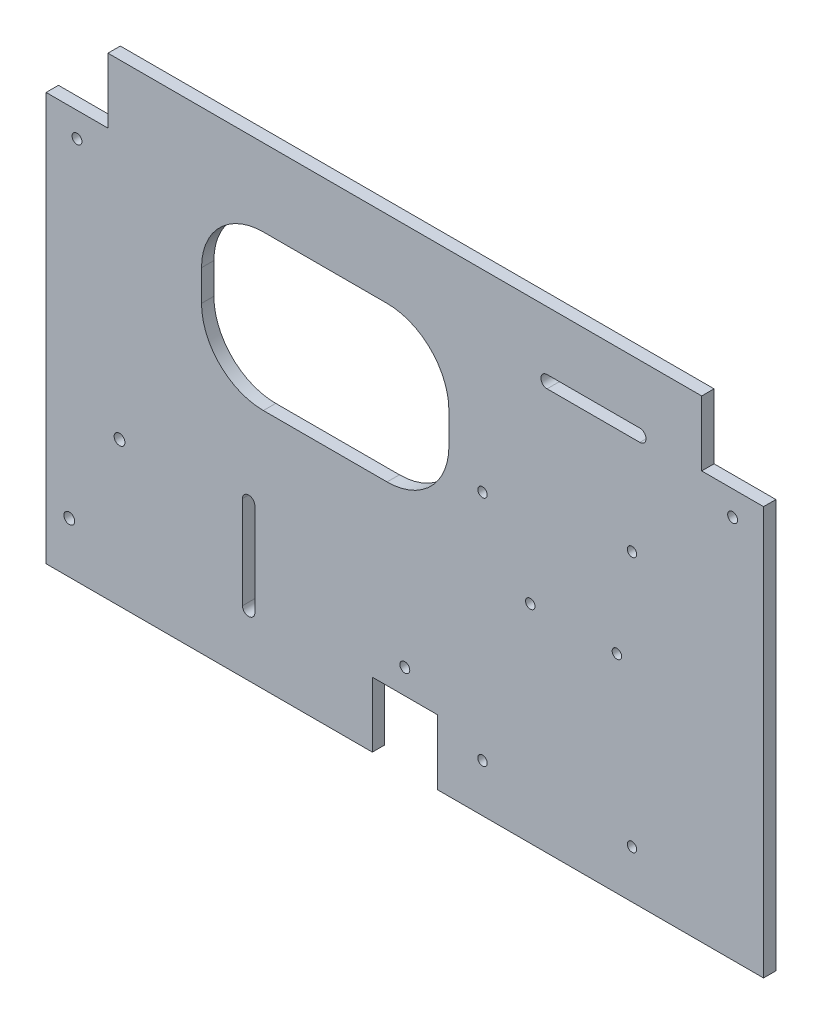
from build123d import *

# Parameters (mm, degrees)
SKETCH1_W           = 232
SKETCH1_H           = 170
BOSS_EXTRUDE1_DEPTH = 4
CUT_EXTRUDE4_DEPTH  = 144.864519601
SKETCH6_R           = 1.523418559
CUT_EXTRUDE5_DEPTH  = 144.864519601
SKETCH8_W           = 232
SKETCH8_H           = 5
CUT_EXTRUDE7_DEPTH  = 144.864519601
SKETCH9_R           = 1.6
CUT_EXTRUDE8_DEPTH  = 144.864519601
SKETCH10_R          = 1.75
CUT_EXTRUDE9_DEPTH  = 144.864519601
SKETCH11_W          = 20
SKETCH11_H          = 33
CUT_EXTRUDE10_DEPTH = 144.864519601
SKETCH12_W          = 21
SKETCH12_H          = 21
CUT_EXTRUDE11_DEPTH = 4
CUT_EXTRUDE12_DEPTH = 4
SKETCH14_W          = 192
SKETCH14_H          = 12
CUT_EXTRUDE13_DEPTH = 4


with BuildPart() as part:
    # Sketch1 → Boss-Extrude1 (new body)
    with BuildSketch(Plane.XY):
        Rectangle(SKETCH1_W, SKETCH1_H)
    extrude(amount=BOSS_EXTRUDE1_DEPTH)

    # Sketch5 → Cut-Extrude4 (cut, through all)
    with BuildSketch(Plane.XY.offset(4)):
        with BuildLine():
            Line((-45.739568187, -1.949021099), (-5.739568187, -1.949021099))
            ThreePointArc((-5.739568187, -1.949021099), (8.402567437, 3.908843277), (14.260431813, 18.050978901))
            Line((14.260431813, 18.050978901), (14.260431813, 28.050978901))
            ThreePointArc((14.260431813, 28.050978901), (8.402567437, 42.193114525), (-5.739568187, 48.050978901))
            Line((-5.739568187, 48.050978901), (-45.739568187, 48.050978901))
            ThreePointArc((-45.739568187, 48.050978901), (-59.881703811, 42.193114525), (-65.739568187, 28.050978901))
            Line((-65.739568187, 28.050978901), (-65.739568187, 18.050978901))
            ThreePointArc((-65.739568187, 18.050978901), (-59.881703811, 3.908843277), (-45.739568187, -1.949021099))
        make_face()
    extrude(amount=-CUT_EXTRUDE4_DEPTH, mode=Mode.SUBTRACT)

    # Sketch6 → Cut-Extrude5 (cut, through all)
    with BuildSketch(Plane.XY.offset(4)):
        with Locations((73.46, 18.098600008)):
            Circle(SKETCH6_R)
        with Locations((25.1238, 10.605600008)):
            Circle(SKETCH6_R)
        with Locations((68.581507234, -12.902099992)):
            Circle(SKETCH6_R)
        with Locations((40.565307234, -12.902099992)):
            Circle(SKETCH6_R)
        with Locations((73.46, -64.527599992)):
            Circle(SKETCH6_R)
        with Locations((25.1238, -64.527599992)):
            Circle(SKETCH6_R)
    extrude(amount=-CUT_EXTRUDE5_DEPTH, mode=Mode.SUBTRACT)

    # Sketch8 → Cut-Extrude7 (cut, through all)
    with BuildSketch(Plane.XY.offset(4)):
        with Locations((0, -82.5)):
            Rectangle(SKETCH8_W, SKETCH8_H)
    extrude(amount=-CUT_EXTRUDE7_DEPTH, mode=Mode.SUBTRACT)

    # Sketch9 → Cut-Extrude8 (cut, through all)
    with BuildSketch(Plane(origin=(0, 0, 0), x_dir=(-1, 0, 0), z_dir=(0, 0, -1))):
        with Locations((106, 44)):
            Circle(SKETCH9_R)
        with Locations((-106, 44)):
            Circle(SKETCH9_R)
        with Locations((0, -51.000000508)):
            Circle(SKETCH9_R)
    extrude(amount=-CUT_EXTRUDE8_DEPTH, mode=Mode.SUBTRACT)

    # Sketch10 → Cut-Extrude9 (cut, through all)
    with BuildSketch(Plane.XY.offset(4)):
        with Locations((-92.249999997, -33.300000021)):
            Circle(SKETCH10_R)
        with Locations((-108.499999997, -63.500000021)):
            Circle(SKETCH10_R)
    extrude(amount=-CUT_EXTRUDE9_DEPTH, mode=Mode.SUBTRACT)

    # Sketch11 → Cut-Extrude10 (cut, through all)
    with BuildSketch(Plane.XY.offset(4)):
        with Locations((106, 68.5)):
            Rectangle(SKETCH11_W, SKETCH11_H)
    cut_extrude10 = extrude(amount=-CUT_EXTRUDE10_DEPTH, mode=Mode.SUBTRACT)

    # Mirror1: Cut-Extrude10 across plane
    add(cut_extrude10.mirror(Plane.ZY), mode=Mode.SUBTRACT)

    # Sketch12 → Cut-Extrude11 (cut)
    with BuildSketch(Plane.XY.offset(4)):
        with Locations((0, -69.5)):
            Rectangle(SKETCH12_W, SKETCH12_H)
    extrude(amount=-CUT_EXTRUDE11_DEPTH, mode=Mode.SUBTRACT)

    # Sketch13 → Cut-Extrude12 (cut)
    with BuildSketch(Plane.XY.offset(4)):
        with BuildLine():
            Line((-48.5, -30), (-48.5, -60))
            ThreePointArc((-48.5, -60), (-50.5, -62), (-52.5, -60))
            Line((-52.5, -60), (-52.5, -30))
            ThreePointArc((-52.5, -30), (-50.5, -28), (-48.5, -30))
        make_face()
        with BuildLine():
            Line((46, 54), (76, 54))
            ThreePointArc((76, 54), (78, 52), (76, 50))
            Line((76, 50), (46, 50))
            ThreePointArc((46, 50), (44, 52), (46, 54))
        make_face()
    extrude(amount=-CUT_EXTRUDE12_DEPTH, mode=Mode.SUBTRACT)

    # Sketch14 → Cut-Extrude13 (cut)
    with BuildSketch(Plane.XY.offset(4)):
        with Locations((0, 79)):
            Rectangle(SKETCH14_W, SKETCH14_H)
    extrude(amount=-CUT_EXTRUDE13_DEPTH, mode=Mode.SUBTRACT)


solid = part.part
